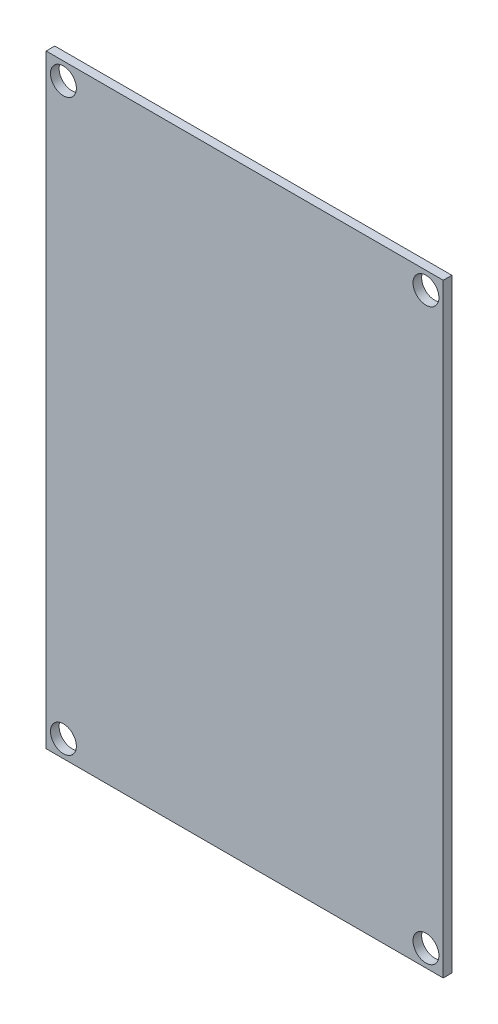
from build123d import *

# Parameters (mm, degrees)
CROQUIS1_W              = 46
CROQUIS1_H              = 70
SALIENTE_EXTRUIR1_DEPTH = 1
CROQUIS2_R              = 1.5
CORTAR_EXTRUIR1_DEPTH   = 1


with BuildPart() as part:
    # Croquis1 → Saliente-Extruir1 (new body)
    with BuildSketch(Plane.XY):
        Rectangle(CROQUIS1_W, CROQUIS1_H)
    extrude(amount=SALIENTE_EXTRUIR1_DEPTH)

    # Croquis2 → Cortar-Extruir1 (cut)
    with BuildSketch(Plane.XY.offset(1)):
        with Locations((-21, -33)):
            Circle(CROQUIS2_R)
        with Locations((21, -33)):
            Circle(CROQUIS2_R)
        with Locations((-21, 33)):
            Circle(CROQUIS2_R)
        with Locations((21, 33)):
            Circle(CROQUIS2_R)
    extrude(amount=-CORTAR_EXTRUIR1_DEPTH, mode=Mode.SUBTRACT)


solid = part.part
